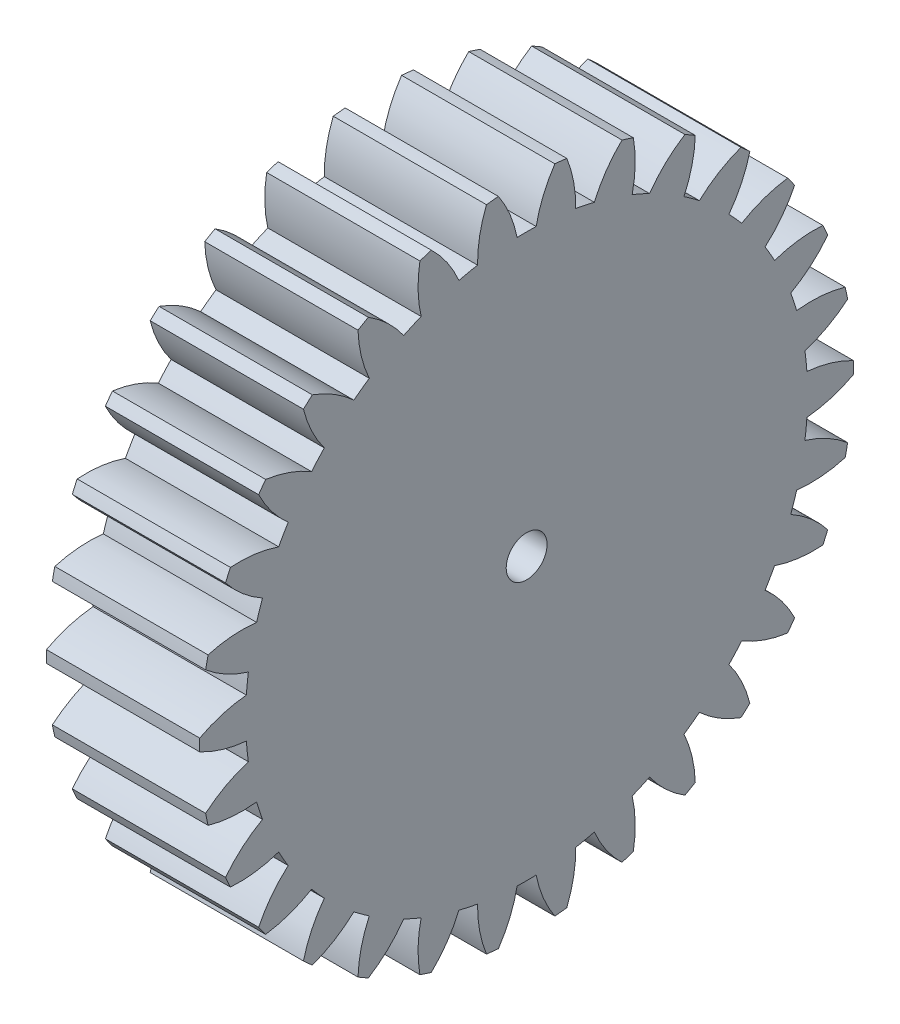
from build123d import *

# Parameters (mm, degrees)
BASPROSKE_W     = 7.5
BASPROSKE_H     = 16
TOOTHCUT_DEPTH  = 24.837994882
TEETHCUTS_COUNT = 30
TEETHCUTS_ANGLE = 348
BORSKE_R        = 1
BORE_DEPTH      = 50.0000508


with BuildPart() as part:
    # BasProSke → Base-Revolve (revolve)
    with BuildSketch(Plane(origin=(0, 0, 0), x_dir=(1, 0, 0), z_dir=(0, 1, 0)), mode=Mode.PRIVATE) as base_revolve_sk:
        with Locations((3.75, 8)):
            Rectangle(BASPROSKE_W, BASPROSKE_H)
    revolve(base_revolve_sk.sketch.rotate(Axis((-10, 0, 0), (1, 0, 0)), 180), axis=Axis((-10, 0, 0), (1, 0, 0)))

    # TooCutSke → ToothCut (cut, through all)
    with BuildSketch(Plane(origin=(0, 0, 0), x_dir=(0, 0, -1), z_dir=(1, 0, 0))):
        with BuildLine():
            ThreePointArc((0.466400716, 13.741086979), (0, 13.749), (-0.466400716, 13.741086979))
            ThreePointArc((-0.466400716, 13.741086979), (-0.819142092, 14.899954875), (-1.3974676, 15.964351834))
            ThreePointArc((-1.3974676, 15.964351834), (0, 16.0254), (1.3974676, 15.964351834))
            ThreePointArc((1.3974676, 15.964351834), (0.819142092, 14.899954875), (0.466400716, 13.741086979))
        make_face()
    toothcut = extrude(amount=TOOTHCUT_DEPTH, mode=Mode.SUBTRACT)

    # TeethCuts: ToothCut ×30 about axis
    teethcuts_axis = Axis((-10, 0, 0), (1, 0, 0))
    for i in range(1, TEETHCUTS_COUNT):
        add(toothcut.rotate(teethcuts_axis, i * TEETHCUTS_ANGLE / (TEETHCUTS_COUNT - 1)), mode=Mode.SUBTRACT)

    # BorSke → Bore (cut, symmetric)
    with BuildSketch(Plane(origin=(0, 0, 0), x_dir=(0, 0, -1), z_dir=(1, 0, 0))):
        with Locations(Location((0, 0, 0), (0, 0, 180))):
            Circle(BORSKE_R)
    extrude(amount=BORE_DEPTH, both=True, mode=Mode.SUBTRACT)


solid = part.part
